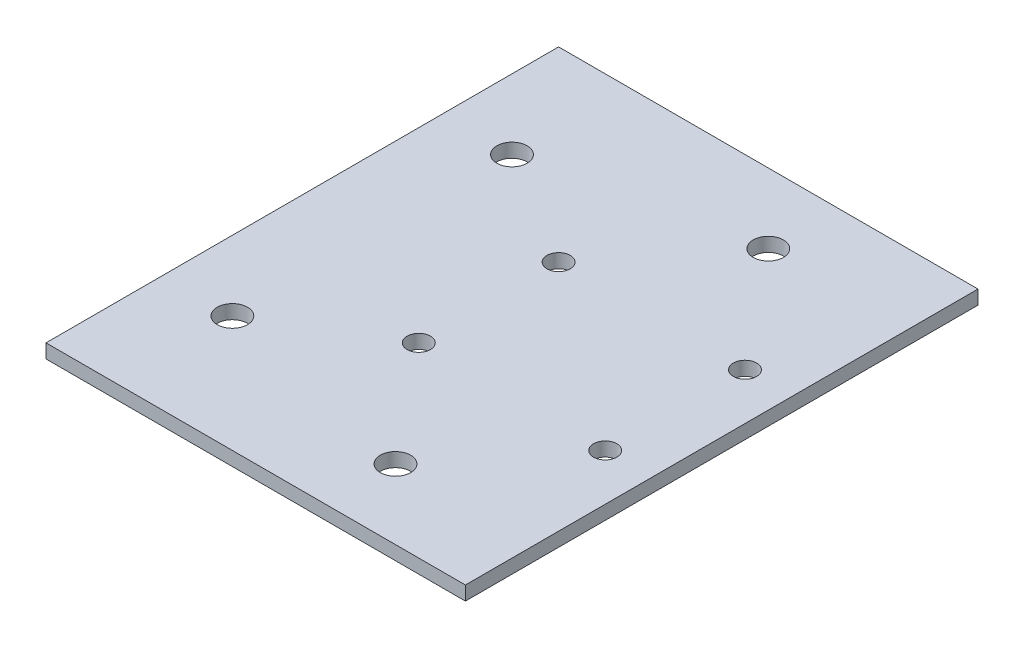
from build123d import *

# Parameters (mm, degrees)
SKETCH1_W           = 90
SKETCH1_H           = 110
SKETCH1_R           = 3.25
SKETCH1_R_2         = 2.5
BOSS_EXTRUDE1_DEPTH = 3


with BuildPart() as part:
    # Sketch1 → Boss-Extrude1 (new body)
    with BuildSketch(Plane(origin=(0, 0, 0), x_dir=(1, 0, 0), z_dir=(0, 1, 0))):
        Rectangle(SKETCH1_W, SKETCH1_H)
        with Locations(Location((-30, 30, 0), (0, 0, 270))):
            Circle(SKETCH1_R, mode=Mode.SUBTRACT)
        with Locations(Location((-30, -30, 0), (0, 0, 270))):
            Circle(SKETCH1_R, mode=Mode.SUBTRACT)
        with Locations(Location((-5, 15, 0), (0, 0, 270))):
            Circle(SKETCH1_R_2, mode=Mode.SUBTRACT)
        with Locations(Location((35, 15, 0), (0, 0, 270))):
            Circle(SKETCH1_R_2, mode=Mode.SUBTRACT)
        with Locations(Location((35, -15, 0), (0, 0, 270))):
            Circle(SKETCH1_R_2, mode=Mode.SUBTRACT)
        with Locations(Location((-5, -15, 0), (0, 0, 270))):
            Circle(SKETCH1_R_2, mode=Mode.SUBTRACT)
        with Locations(Location((15, -40, 0), (0, 0, 270))):
            Circle(SKETCH1_R, mode=Mode.SUBTRACT)
        with Locations(Location((15, 40, 0), (0, 0, 270))):
            Circle(SKETCH1_R, mode=Mode.SUBTRACT)
    extrude(amount=BOSS_EXTRUDE1_DEPTH)


solid = part.part
